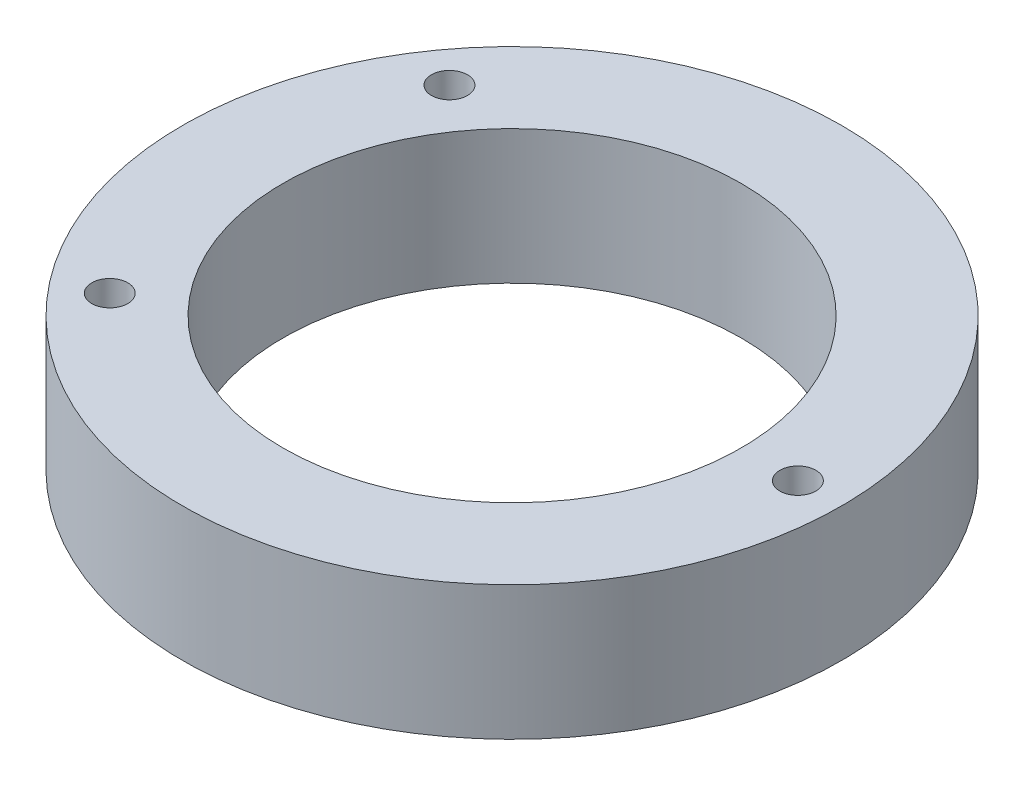
from build123d import *

# Parameters (mm, degrees)
SKETCH1_R           = 32
SKETCH1_R_2         = 22.25
SKETCH1_R_3         = 1.75
BOSS_EXTRUDE1_DEPTH = 13


with BuildPart() as part:
    # Sketch1 → Boss-Extrude1 (new body)
    with BuildSketch(Plane(origin=(0, 0, 0), x_dir=(1, 0, 0), z_dir=(0, 1, 0))):
        with Locations(Location((0, 0, 0), (0, 0, 90))):
            Circle(SKETCH1_R)
        with Locations(Location((0, 0, 0), (0, 0, 90))):
            Circle(SKETCH1_R_2, mode=Mode.SUBTRACT)
        with Locations(Location((27.75, 0, 0), (0, 0, 90))):
            Circle(SKETCH1_R_3, mode=Mode.SUBTRACT)
        with Locations(Location((-22.424830869, 16.345931008, 0), (0, 0, 90))):
            Circle(SKETCH1_R_3, mode=Mode.SUBTRACT)
        with Locations(Location((-21.421542654, -17.640295075, 0), (0, 0, 90))):
            Circle(SKETCH1_R_3, mode=Mode.SUBTRACT)
    extrude(amount=BOSS_EXTRUDE1_DEPTH)


solid = part.part
